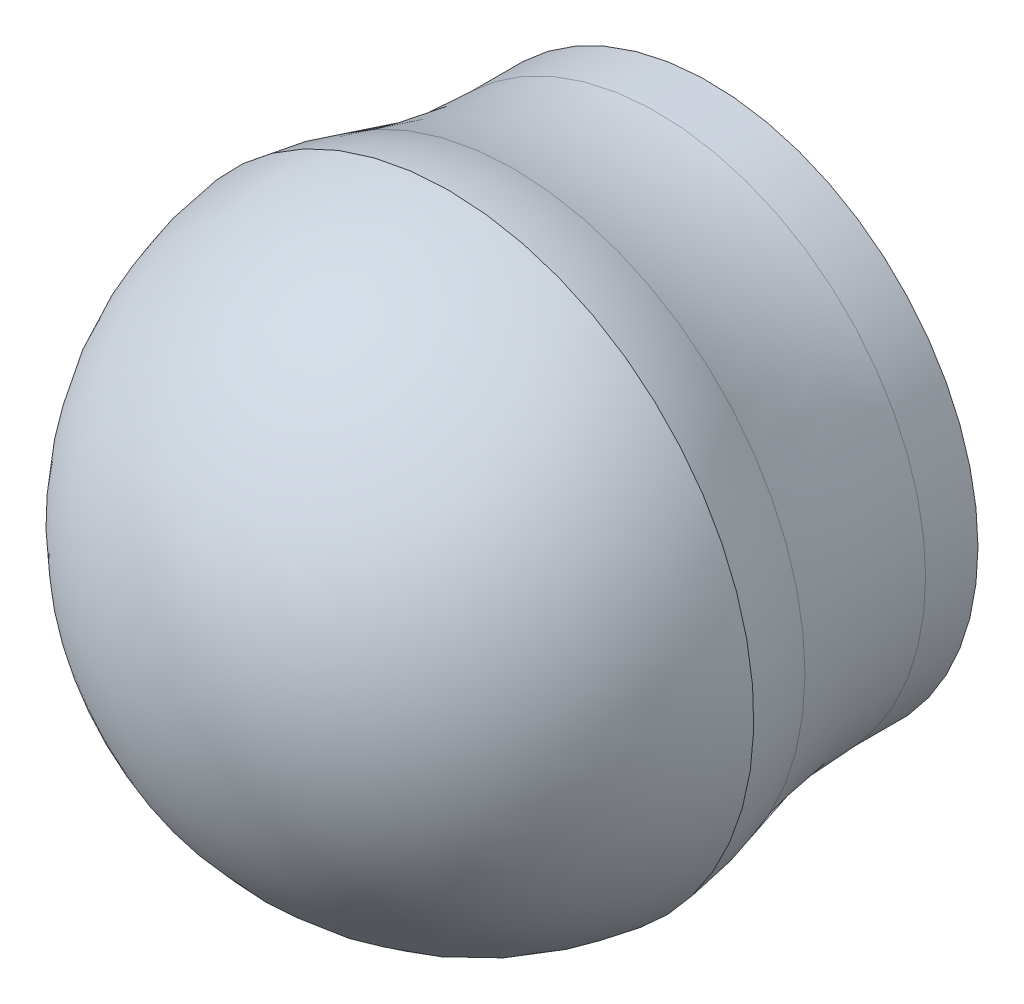
from build123d import *

# Parameters (mm, degrees)
ESTRUSIONE_ESTRUSIONE1_REACH      = 63.48
ESTRUSIONE_ESTRUSIONE1_END_RADIUS = 18
ESTRUSIONE_ESTRUSIONE1_START      = -16.57
SCHIZZO3_R                        = 5


with BuildPart() as part:
    # Schizzo1 → Rivoluzione1 (revolve)
    with BuildSketch(Plane(origin=(0, 0, 0), x_dir=(0, 0, -1), z_dir=(1, 0, 0))):
        with BuildLine():
            Line((-46.259570065, 17.5), (-42.84743692, 17.5))
            Line((-42.84743692, 17.5), (-42.84743692, 15.5))
            Line((-42.84743692, 15.5), (-46.259570065, 15.5))
            ThreePointArc((-46.259570065, 15.5), (-51.319214322, 15.902531747), (-56.251566863, 17.1))
            ThreePointArc((-56.251566863, 17.1), (-58.035417815, 17.58636227), (-59.85975099, 17.887162773))
            ThreePointArc((-59.85975099, 17.887162773), (-71.267974414, 11.995381335), (-75.84743692, 0))
            Line((-75.84743692, 0), (-77.84743692, 0))
            ThreePointArc((-77.84743692, 0), (-72.683984385, 13.411817897), (-59.85975099, 19.898507283))
            ThreePointArc((-59.85975099, 19.898507283), (-57.719038516, 19.56405813), (-55.627067063, 19))
            ThreePointArc((-55.627067063, 19), (-51.002986556, 17.877373513), (-46.259570065, 17.5))
        make_face()
    revolve(axis=Axis((0, 0, 77.84743692), (0, 0, -1)))

    # Estrusione-Estrusione1: up to this sphere (the profile starts inside it)
    estrusione_estrusione1_end = Location((0, 0, 57.84743692)) * Sphere(ESTRUSIONE_ESTRUSIONE1_END_RADIUS, mode=Mode.PRIVATE)
    # Schizzo3 → Estrusione-Estrusione1 (add, up to the surface)
    with BuildSketch(Plane(origin=(0, 0, 42.84743692), x_dir=(-1, 0, 0), z_dir=(0, 0, -1)).offset(ESTRUSIONE_ESTRUSIONE1_START), mode=Mode.PRIVATE) as estrusione_estrusione1_sk1:
        with BuildLine():
            Line((-17.87143229, -0.75), (-7.462405778, -0.75))
            ThreePointArc((-7.462405778, -0.75), (-5.303300859, -5.303300859), (-0.75, -7.462405778))
            Line((-0.75, -7.462405778), (-0.75, -17.87143229))
            ThreePointArc((-0.75, -17.87143229), (0, -17.887162773), (0.75, -17.87143229))
            Line((0.75, -17.87143229), (0.75, -7.462405778))
            ThreePointArc((0.75, -7.462405778), (5.303300859, -5.303300859), (7.462405778, -0.75))
            Line((7.462405778, -0.75), (17.87143229, -0.75))
            ThreePointArc((17.87143229, -0.75), (17.887162773, 0), (17.87143229, 0.75))
            Line((17.87143229, 0.75), (7.462405778, 0.75))
            ThreePointArc((7.462405778, 0.75), (5.303300859, 5.303300859), (0.75, 7.462405778))
            Line((0.75, 7.462405778), (0.75, 17.87143229))
            ThreePointArc((0.75, 17.87143229), (0, 17.887162773), (-0.75, 17.87143229))
            Line((-0.75, 17.87143229), (-0.75, 7.462405778))
            ThreePointArc((-0.75, 7.462405778), (-5.303300859, 5.303300859), (-7.462405778, 0.75))
            Line((-7.462405778, 0.75), (-17.87143229, 0.75))
            ThreePointArc((-17.87143229, 0.75), (-17.887162773, 0), (-17.87143229, -0.75))
        make_face()
        Circle(SCHIZZO3_R, mode=Mode.SUBTRACT)
    estrusione_estrusione1_tool1 = extrude(estrusione_estrusione1_sk1.sketch, amount=-ESTRUSIONE_ESTRUSIONE1_REACH, mode=Mode.PRIVATE) & estrusione_estrusione1_end
    add(estrusione_estrusione1_tool1.solids().sort_by_distance((12.666919, -0.244075, 59.417437))[0])


solid = part.part
